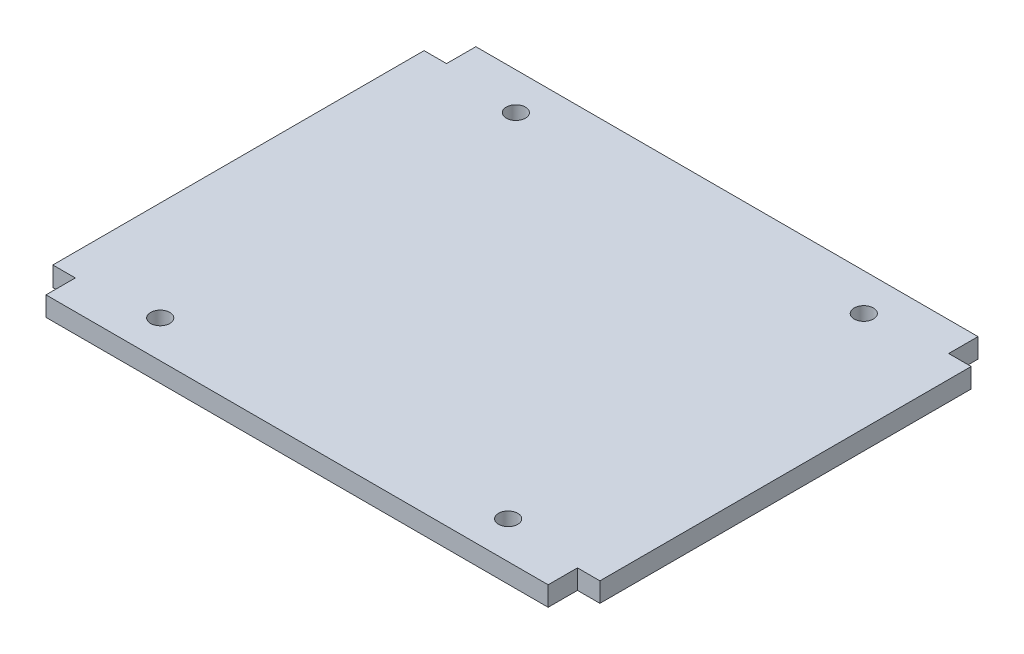
from build123d import *

# Parameters (mm, degrees)
SKETCH2_R           = 1.25
BOSS_EXTRUDE2_DEPTH = 1.27


with BuildPart() as part:
    # Sketch2 → Boss-Extrude2 (new, symmetric)
    with BuildSketch(Plane(origin=(0, 0, 0), x_dir=(1, 0, 0), z_dir=(0, 1, 0))):
        Polygon((32.639, 24.13), (35.56, 24.13), (35.56, -24.13), (32.639, -24.13), (32.639, -27.94), (-32.639, -27.94), (-32.639, -24.13), (-35.56, -24.13), (-35.56, 24.13), (-32.639, 24.13), (-32.639, 27.94), (32.639, 27.94), align=None)
        with Locations(Location((-22.615, 23.115, 0), (0, 0, 270))):
            Circle(SKETCH2_R, mode=Mode.SUBTRACT)
        with Locations(Location((22.615, 23.115, 0), (0, 0, 270))):
            Circle(SKETCH2_R, mode=Mode.SUBTRACT)
        with Locations(Location((22.615, -23.115, 0), (0, 0, 90))):
            Circle(SKETCH2_R, mode=Mode.SUBTRACT)
        with Locations(Location((-22.615, -23.115, 0), (0, 0, 90))):
            Circle(SKETCH2_R, mode=Mode.SUBTRACT)
    extrude(amount=BOSS_EXTRUDE2_DEPTH, both=True)


solid = part.part
